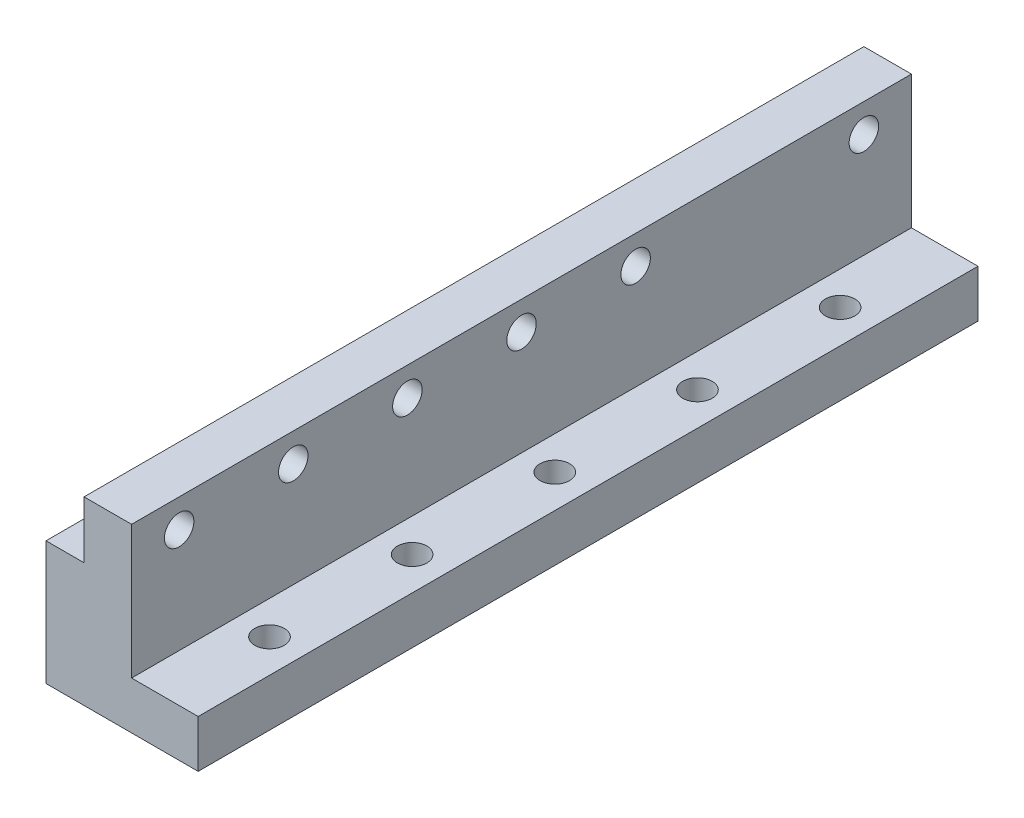
from build123d import *

# Parameters (mm, degrees)
EXTRUDE_1_DEPTH        = 82
SKETCH_2_R             = 1.55
CUT_EXTRUDE_1_DEPTH    = 85.711274338
SKETCH_3_R             = 1.55
CUT_EXTRUDE_2_DEPTH    = 84.886828525
PATTERN_LINEAR_1_COUNT = 5
PATTERN_LINEAR_1_PITCH = 15


with BuildPart() as part:
    # 草圖1 → 填料-伸長1 (new body)
    with BuildSketch(Plane.XY):
        Polygon((4, 6), (4, 0), (0, 0), (0, -13), (16, -13), (16, -8), (9, -8), (9, 6), align=None)
    extrude(amount=EXTRUDE_1_DEPTH)

    # 草圖2 → 除料-伸長1 (cut, through all)
    with BuildSketch(Plane(origin=(0, -8, 0), x_dir=(1, 0, 0), z_dir=(0, 1, 0))):
        with Locations(Location((12.5, -71, 0), (0, 0, 90))):
            Circle(SKETCH_2_R)
    cut_extrude_1 = extrude(amount=-CUT_EXTRUDE_1_DEPTH, mode=Mode.SUBTRACT)

    # 草圖3 → 除料-伸長2 (cut, through all)
    with BuildSketch(Plane.ZY.offset(-4)):
        with Locations(Location((5, 3, 0), (0, 0, 270))):
            Circle(SKETCH_3_R)
        with Locations(Location((29, 3, 0), (0, 0, 270))):
            Circle(SKETCH_3_R)
        with Locations(Location((41, 3, 0), (0, 0, 270))):
            Circle(SKETCH_3_R)
        with Locations(Location((53, 3, 0), (0, 0, 270))):
            Circle(SKETCH_3_R)
        with Locations(Location((65, 3, 0), (0, 0, 270))):
            Circle(SKETCH_3_R)
        with Locations(Location((77, 3, 0), (0, 0, 270))):
            Circle(SKETCH_3_R)
    extrude(amount=-CUT_EXTRUDE_2_DEPTH, mode=Mode.SUBTRACT)

    # 直線複製排列1: 除料-伸長1 ×5
    with Locations(*[(0, 0, -i * PATTERN_LINEAR_1_PITCH) for i in range(1, PATTERN_LINEAR_1_COUNT)]):
        add(cut_extrude_1, mode=Mode.SUBTRACT)


solid = part.part
